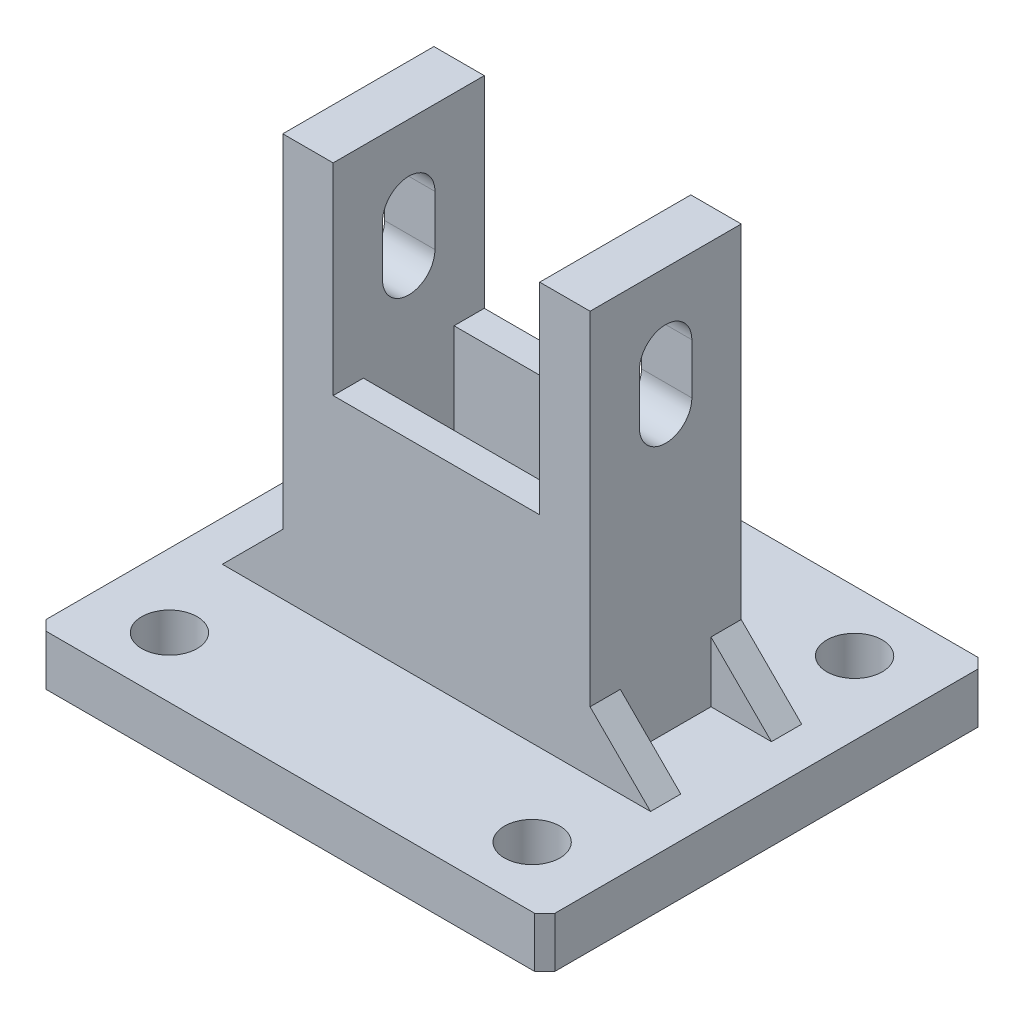
from build123d import *

# Parameters (mm, degrees)
SKETCH1_W           = 50.5
SKETCH1_H           = 44
SKETCH1_R           = 2.75
BOSS_EXTRUDE1_DEPTH = 5
BOSS_EXTRUDE2_START = -14.5
SKETCH3_W           = 5
SKETCH3_H           = 40
BOSS_EXTRUDE2_DEPTH = 15
CUT_EXTRUDE1_REACH  = 66.415
SKETCH5_W           = 20.5
SKETCH5_H           = 20
BOSS_EXTRUDE3_DEPTH = 3
CHAMFER2_SIZE       = 1


with BuildPart() as part:
    # Sketch1 → Boss-Extrude1 (new body)
    with BuildSketch(Plane(origin=(0, 0, 0), x_dir=(1, 0, 0), z_dir=(0, 1, 0))):
        Rectangle(SKETCH1_W, SKETCH1_H)
        with Locations(Location((-18, 16, 0), (0, 0, 270))):
            Circle(SKETCH1_R, mode=Mode.SUBTRACT)
        with Locations(Location((18, 16, 0), (0, 0, 270))):
            Circle(SKETCH1_R, mode=Mode.SUBTRACT)
        with Locations(Location((18, -16, 0), (0, 0, 270))):
            Circle(SKETCH1_R, mode=Mode.SUBTRACT)
        with Locations(Location((-18, -16, 0), (0, 0, 270))):
            Circle(SKETCH1_R, mode=Mode.SUBTRACT)
    extrude(amount=BOSS_EXTRUDE1_DEPTH)

    # Sketch3 → Boss-Extrude2 (add)
    with BuildSketch(Plane.XY.offset(22).offset(BOSS_EXTRUDE2_START)):
        with Locations((-12.75, 25)):
            Rectangle(SKETCH3_W, SKETCH3_H)
        with Locations((12.75, 25)):
            Rectangle(SKETCH3_W, SKETCH3_H)
    extrude(amount=-BOSS_EXTRUDE2_DEPTH)

    # Cut-Extrude1: up to this face of the body (flat: up to its plane)
    cut_extrude1_end = Plane(part.part.faces().sort_by_distance((-15.25, 25, 0))[0])
    # Sketch4 → Cut-Extrude1 (cut, up to the picked face)
    with BuildSketch(Plane(origin=(15.25, 0, 0), x_dir=(0, 0, -1), z_dir=(1, 0, 0)), mode=Mode.PRIVATE) as cut_extrude1_sk1:
        with BuildLine():
            Line((2.6, 37.5), (2.6, 32.5))
            ThreePointArc((2.6, 32.5), (0, 29.9), (-2.6, 32.5))
            Line((-2.6, 32.5), (-2.6, 37.5))
            ThreePointArc((-2.6, 37.5), (0, 40.1), (2.6, 37.5))
        make_face()
    cut_extrude1_tool1 = split(extrude(cut_extrude1_sk1.sketch, amount=-CUT_EXTRUDE1_REACH, mode=Mode.PRIVATE), bisect_by=cut_extrude1_end, keep=Keep.BOTH, mode=Mode.PRIVATE)
    add(cut_extrude1_tool1.solids().sort_by(Axis((15.25, 35, 0), (-1, 0, 0)))[0], mode=Mode.SUBTRACT)

    # Sketch5 → Boss-Extrude3 (add)
    with BuildSketch(Plane.XY.offset(7.5)):
        Polygon((15.25, 11), (21.25, 5), (15.25, 5), align=None)
        Polygon((-21.25, 5), (-15.25, 5), (-15.25, 11), align=None)
        with Locations((0, 15)):
            Rectangle(SKETCH5_W, SKETCH5_H)
    boss_extrude3 = extrude(amount=-BOSS_EXTRUDE3_DEPTH)

    # Mirror1: Boss-Extrude3 across plane
    add(boss_extrude3.mirror(Plane(origin=(0, 0, 0), x_dir=(1, 0, 0), z_dir=(0, 0, -1))))

    # Chamfer2
    chamfer2_edges = [part.edges().sort_by_distance(p)[0] for p in [
        (25.25, 2.5, 22),
        (-25.25, 2.5, 22),
        (-25.25, 2.5, -22),
        (25.25, 2.5, -22),
    ]]
    chamfer(chamfer2_edges, length=CHAMFER2_SIZE)


solid = part.part
